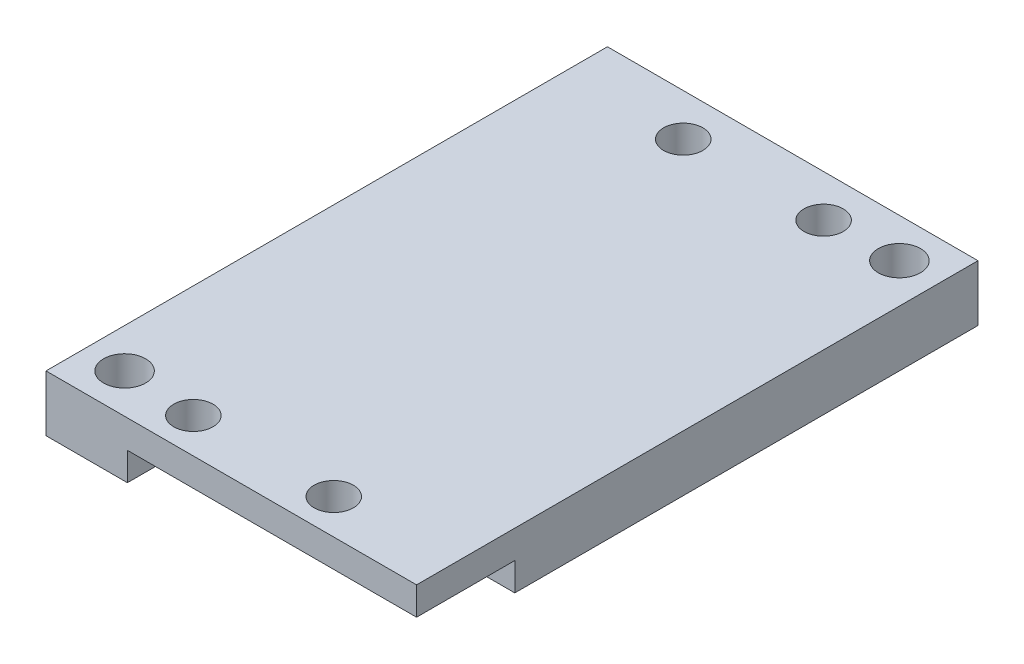
from build123d import *

# Parameters (mm, degrees)
SKETCH_1_W          = 13.2
SKETCH_1_H          = 20
EXTRUDE_1_DEPTH     = 2
SKETCH_1_3_R        = 0.75
CUT_EXTRUDE_2_DEPTH = 13.147427711
CUT_EXTRUDE_START   = -2
SKETCH_2_W          = 10.3
SKETCH_2_H          = 3.5
CUT_EXTRUDE_1_DEPTH = 1
SKETCH_2_3_R        = 0.7
CUT_EXTRUDE_4_DEPTH = 13.147427711


with BuildPart() as part:
    # 草图1 → 凸台-拉伸1 (new body)
    with BuildSketch(Plane(origin=(0, 0, 0), x_dir=(1, 0, 0), z_dir=(0, 1, 0))):
        Rectangle(SKETCH_1_W, SKETCH_1_H)
    extrude(amount=EXTRUDE_1_DEPTH)

    # 草图1<3> → 切除-拉伸2 (cut, through all)
    with BuildSketch(Plane(origin=(0, 0, 0), x_dir=(1, 0, 0), z_dir=(0, 1, 0))):
        with Locations(Location((-5.2, -8.6, 0), (0, 0, 270))):
            Circle(SKETCH_1_3_R)
        with Locations(Location((5.2, 8.6, 0), (0, 0, 270))):
            Circle(SKETCH_1_3_R)
    extrude(amount=CUT_EXTRUDE_2_DEPTH, mode=Mode.SUBTRACT)

    # 草图2 → 切除-拉伸1 (cut)
    with BuildSketch(Plane(origin=(0, 2, 0), x_dir=(1, 0, 0), z_dir=(0, 1, 0)).offset(CUT_EXTRUDE_START)):
        with Locations((-1.45, 8.25)):
            Rectangle(SKETCH_2_W, SKETCH_2_H)
        with Locations((1.45, -8.25)):
            Rectangle(SKETCH_2_W, SKETCH_2_H)
    extrude(amount=CUT_EXTRUDE_1_DEPTH, mode=Mode.SUBTRACT)

    # 草图2<3> → 切除-拉伸4 (cut, through all)
    with BuildSketch(Plane(origin=(0, 2, 0), x_dir=(1, 0, 0), z_dir=(0, 1, 0))):
        with Locations(Location((-2.6, -8.75, 0), (0, 0, 270))):
            Circle(SKETCH_2_3_R)
        with Locations(Location((2.4, -8.75, 0), (0, 0, 270))):
            Circle(SKETCH_2_3_R)
        with Locations(Location((-2.4, 8.5, 0), (0, 0, 270))):
            Circle(SKETCH_2_3_R)
        with Locations(Location((2.6, 8.5, 0), (0, 0, 270))):
            Circle(SKETCH_2_3_R)
    extrude(amount=-CUT_EXTRUDE_4_DEPTH, mode=Mode.SUBTRACT)


solid = part.part
